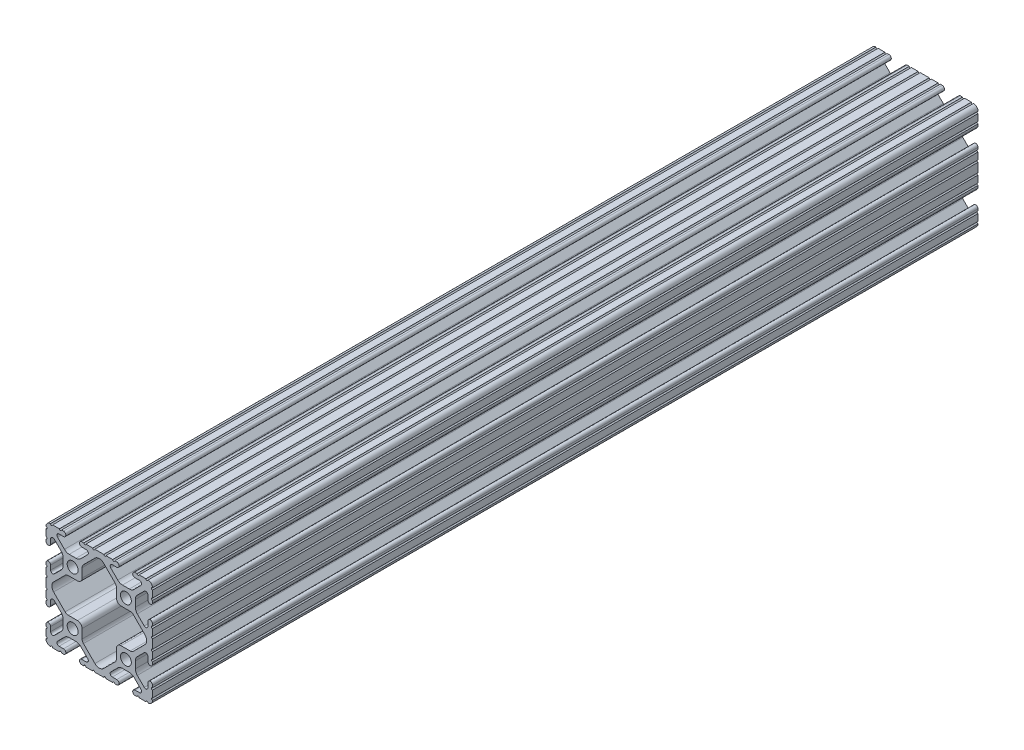
from build123d import *

# Parameters (mm, degrees)
SKETCH1_R      = 2.6035
EXTRUDE1_DEPTH = 196.85


with BuildPart() as part:
    # Sketch1 → Extrude1 (new, symmetric)
    with BuildSketch(Plane.XY):
        with BuildLine():
            Line((-2.1336, -25.4), (2.1336, -25.4))
            ThreePointArc((2.1336, -25.4), (2.6416, -24.892), (3.1496, -25.4))
            Line((3.1496, -25.4), (6.3754, -25.4))
            ThreePointArc((6.3754, -25.4), (6.8834, -24.892), (7.3914, -25.4))
            Line((7.3914, -25.4), (8.3439, -25.4))
            ThreePointArc((8.3439, -25.4), (9.4488, -24.2951), (8.3439, -23.1902))
            Line((8.3439, -23.1902), (6.225205544, -23.1902))
            ThreePointArc((6.225205544, -23.1902), (5.286543939, -22.563006367), (5.506785055, -21.45577951))
            Line((5.506785055, -21.45577951), (8.824128595, -18.13843597))
            ThreePointArc((8.824128595, -18.13843597), (9.854172728, -17.450182484), (11.069192626, -17.2085))
            Line((11.069192626, -17.2085), (14.330807374, -17.2085))
            ThreePointArc((14.330807374, -17.2085), (15.545827272, -17.450182484), (16.575871405, -18.13843597))
            Line((16.575871405, -18.13843597), (19.893214945, -21.45577951))
            ThreePointArc((19.893214945, -21.45577951), (20.113456061, -22.563006367), (19.174794456, -23.1902))
            Line((19.174794456, -23.1902), (17.0561, -23.1902))
            ThreePointArc((17.0561, -23.1902), (15.9512, -24.2951), (17.0561, -25.4))
            Line((17.0561, -25.4), (18.0086, -25.4))
            ThreePointArc((18.0086, -25.4), (18.5166, -24.892), (19.0246, -25.4))
            Line((19.0246, -25.4), (22.2504, -25.4))
            ThreePointArc((22.2504, -25.4), (22.7584, -24.892), (23.2664, -25.4))
            Line((23.2664, -25.4), (23.2918, -25.4))
            ThreePointArc((23.2918, -25.4), (24.782522516, -24.782522516), (25.4, -23.2918))
            Line((25.4, -23.2918), (25.4, -23.2664))
            ThreePointArc((25.4, -23.2664), (24.892, -22.7584), (25.4, -22.2504))
            Line((25.4, -22.2504), (25.4, -19.0246))
            ThreePointArc((25.4, -19.0246), (24.892, -18.5166), (25.4, -18.0086))
            Line((25.4, -18.0086), (25.4, -17.0561))
            ThreePointArc((25.4, -17.0561), (24.2951, -15.9512), (23.1902, -17.0561))
            Line((23.1902, -17.0561), (23.1902, -19.174794456))
            ThreePointArc((23.1902, -19.174794456), (22.563006367, -20.113456061), (21.45577951, -19.893214945))
            Line((21.45577951, -19.893214945), (18.13843597, -16.575871405))
            ThreePointArc((18.13843597, -16.575871405), (17.450182484, -15.545827272), (17.2085, -14.330807374))
            Line((17.2085, -14.330807374), (17.2085, -11.069192626))
            ThreePointArc((17.2085, -11.069192626), (17.450182484, -9.854172728), (18.13843597, -8.824128595))
            Line((18.13843597, -8.824128595), (21.45577951, -5.506785055))
            ThreePointArc((21.45577951, -5.506785055), (22.563006367, -5.286543939), (23.1902, -6.225205544))
            Line((23.1902, -6.225205544), (23.1902, -8.3439))
            ThreePointArc((23.1902, -8.3439), (24.2951, -9.4488), (25.4, -8.3439))
            Line((25.4, -8.3439), (25.4, -7.3914))
            ThreePointArc((25.4, -7.3914), (24.892, -6.8834), (25.4, -6.3754))
            Line((25.4, -6.3754), (25.4, -3.1496))
            ThreePointArc((25.4, -3.1496), (24.892, -2.6416), (25.4, -2.1336))
            Line((25.4, -2.1336), (25.4, 2.1336))
            ThreePointArc((25.4, 2.1336), (24.892, 2.6416), (25.4, 3.1496))
            Line((25.4, 3.1496), (25.4, 6.3754))
            ThreePointArc((25.4, 6.3754), (24.892, 6.8834), (25.4, 7.3914))
            Line((25.4, 7.3914), (25.4, 8.3439))
            ThreePointArc((25.4, 8.3439), (24.2951, 9.4488), (23.1902, 8.3439))
            Line((23.1902, 8.3439), (23.1902, 6.225205544))
            ThreePointArc((23.1902, 6.225205544), (22.563006367, 5.286543939), (21.45577951, 5.506785055))
            Line((21.45577951, 5.506785055), (18.13843597, 8.824128595))
            ThreePointArc((18.13843597, 8.824128595), (17.450182484, 9.854172728), (17.2085, 11.069192626))
            Line((17.2085, 11.069192626), (17.2085, 14.330807374))
            ThreePointArc((17.2085, 14.330807374), (17.450182484, 15.545827272), (18.13843597, 16.575871405))
            Line((18.13843597, 16.575871405), (21.45577951, 19.893214945))
            ThreePointArc((21.45577951, 19.893214945), (22.563006367, 20.113456061), (23.1902, 19.174794456))
            Line((23.1902, 19.174794456), (23.1902, 17.0561))
            ThreePointArc((23.1902, 17.0561), (24.2951, 15.9512), (25.4, 17.0561))
            Line((25.4, 17.0561), (25.4, 18.0086))
            ThreePointArc((25.4, 18.0086), (24.892, 18.5166), (25.4, 19.0246))
            Line((25.4, 19.0246), (25.4, 22.2504))
            ThreePointArc((25.4, 22.2504), (24.892, 22.7584), (25.4, 23.2664))
            Line((25.4, 23.2664), (25.4, 23.2918))
            ThreePointArc((25.4, 23.2918), (24.782522516, 24.782522516), (23.2918, 25.4))
            Line((23.2918, 25.4), (23.2664, 25.4))
            ThreePointArc((23.2664, 25.4), (22.7584, 24.892), (22.2504, 25.4))
            Line((22.2504, 25.4), (19.0246, 25.4))
            ThreePointArc((19.0246, 25.4), (18.5166, 24.892), (18.0086, 25.4))
            Line((18.0086, 25.4), (17.0561, 25.4))
            ThreePointArc((17.0561, 25.4), (15.9512, 24.2951), (17.0561, 23.1902))
            Line((17.0561, 23.1902), (19.174794456, 23.1902))
            ThreePointArc((19.174794456, 23.1902), (20.113456061, 22.563006367), (19.893214945, 21.45577951))
            Line((19.893214945, 21.45577951), (16.575871405, 18.13843597))
            ThreePointArc((16.575871405, 18.13843597), (15.545827272, 17.450182484), (14.330807374, 17.2085))
            Line((14.330807374, 17.2085), (11.069192626, 17.2085))
            ThreePointArc((11.069192626, 17.2085), (9.854172728, 17.450182484), (8.824128595, 18.13843597))
            Line((8.824128595, 18.13843597), (5.506785055, 21.45577951))
            ThreePointArc((5.506785055, 21.45577951), (5.286543939, 22.563006367), (6.225205544, 23.1902))
            Line((6.225205544, 23.1902), (8.3439, 23.1902))
            ThreePointArc((8.3439, 23.1902), (9.4488, 24.2951), (8.3439, 25.4))
            Line((8.3439, 25.4), (7.3914, 25.4))
            ThreePointArc((7.3914, 25.4), (6.8834, 24.892), (6.3754, 25.4))
            Line((6.3754, 25.4), (3.1496, 25.4))
            ThreePointArc((3.1496, 25.4), (2.6416, 24.892), (2.1336, 25.4))
            Line((2.1336, 25.4), (-2.1336, 25.4))
            ThreePointArc((-2.1336, 25.4), (-2.6416, 24.892), (-3.1496, 25.4))
            Line((-3.1496, 25.4), (-6.3754, 25.4))
            ThreePointArc((-6.3754, 25.4), (-6.8834, 24.892), (-7.3914, 25.4))
            Line((-7.3914, 25.4), (-8.3439, 25.4))
            ThreePointArc((-8.3439, 25.4), (-9.4488, 24.2951), (-8.3439, 23.1902))
            Line((-8.3439, 23.1902), (-6.225205544, 23.1902))
            ThreePointArc((-6.225205544, 23.1902), (-5.286543939, 22.563006367), (-5.506785055, 21.45577951))
            Line((-5.506785055, 21.45577951), (-8.824128595, 18.13843597))
            ThreePointArc((-8.824128595, 18.13843597), (-9.854172728, 17.450182484), (-11.069192626, 17.2085))
            Line((-11.069192626, 17.2085), (-14.330807374, 17.2085))
            ThreePointArc((-14.330807374, 17.2085), (-15.545827272, 17.450182484), (-16.575871405, 18.13843597))
            Line((-16.575871405, 18.13843597), (-19.893214945, 21.45577951))
            ThreePointArc((-19.893214945, 21.45577951), (-20.113456061, 22.563006367), (-19.174794456, 23.1902))
            Line((-19.174794456, 23.1902), (-17.0561, 23.1902))
            ThreePointArc((-17.0561, 23.1902), (-15.9512, 24.2951), (-17.0561, 25.4))
            Line((-17.0561, 25.4), (-18.0086, 25.4))
            ThreePointArc((-18.0086, 25.4), (-18.5166, 24.892), (-19.0246, 25.4))
            Line((-19.0246, 25.4), (-22.2504, 25.4))
            ThreePointArc((-22.2504, 25.4), (-22.7584, 24.892), (-23.2664, 25.4))
            Line((-23.2664, 25.4), (-23.2918, 25.4))
            ThreePointArc((-23.2918, 25.4), (-24.782522516, 24.782522516), (-25.4, 23.2918))
            Line((-25.4, 23.2918), (-25.4, 23.2664))
            ThreePointArc((-25.4, 23.2664), (-24.892, 22.7584), (-25.4, 22.2504))
            Line((-25.4, 22.2504), (-25.4, 19.0246))
            ThreePointArc((-25.4, 19.0246), (-24.892, 18.5166), (-25.4, 18.0086))
            Line((-25.4, 18.0086), (-25.4, 17.0561))
            ThreePointArc((-25.4, 17.0561), (-24.2951, 15.9512), (-23.1902, 17.0561))
            Line((-23.1902, 17.0561), (-23.1902, 19.174794456))
            ThreePointArc((-23.1902, 19.174794456), (-22.563006367, 20.113456061), (-21.45577951, 19.893214945))
            Line((-21.45577951, 19.893214945), (-18.13843597, 16.575871405))
            ThreePointArc((-18.13843597, 16.575871405), (-17.450182484, 15.545827272), (-17.2085, 14.330807374))
            Line((-17.2085, 14.330807374), (-17.2085, 11.069192626))
            ThreePointArc((-17.2085, 11.069192626), (-17.450182484, 9.854172728), (-18.13843597, 8.824128595))
            Line((-18.13843597, 8.824128595), (-21.45577951, 5.506785055))
            ThreePointArc((-21.45577951, 5.506785055), (-22.563006367, 5.286543939), (-23.1902, 6.225205544))
            Line((-23.1902, 6.225205544), (-23.1902, 8.3439))
            ThreePointArc((-23.1902, 8.3439), (-24.2951, 9.4488), (-25.4, 8.3439))
            Line((-25.4, 8.3439), (-25.4, 7.3914))
            ThreePointArc((-25.4, 7.3914), (-24.892, 6.8834), (-25.4, 6.3754))
            Line((-25.4, 6.3754), (-25.4, 3.1496))
            ThreePointArc((-25.4, 3.1496), (-24.892, 2.6416), (-25.4, 2.1336))
            Line((-25.4, 2.1336), (-25.4, -2.1336))
            ThreePointArc((-25.4, -2.1336), (-24.892, -2.6416), (-25.4, -3.1496))
            Line((-25.4, -3.1496), (-25.4, -6.3754))
            ThreePointArc((-25.4, -6.3754), (-24.892, -6.8834), (-25.4, -7.3914))
            Line((-25.4, -7.3914), (-25.4, -8.3439))
            ThreePointArc((-25.4, -8.3439), (-24.2951, -9.4488), (-23.1902, -8.3439))
            Line((-23.1902, -8.3439), (-23.1902, -6.225205544))
            ThreePointArc((-23.1902, -6.225205544), (-22.563006367, -5.286543939), (-21.45577951, -5.506785055))
            Line((-21.45577951, -5.506785055), (-18.13843597, -8.824128595))
            ThreePointArc((-18.13843597, -8.824128595), (-17.450182484, -9.854172728), (-17.2085, -11.069192626))
            Line((-17.2085, -11.069192626), (-17.2085, -14.330807374))
            ThreePointArc((-17.2085, -14.330807374), (-17.450182484, -15.545827272), (-18.13843597, -16.575871405))
            Line((-18.13843597, -16.575871405), (-21.45577951, -19.893214945))
            ThreePointArc((-21.45577951, -19.893214945), (-22.563006367, -20.113456061), (-23.1902, -19.174794456))
            Line((-23.1902, -19.174794456), (-23.1902, -17.0561))
            ThreePointArc((-23.1902, -17.0561), (-24.2951, -15.9512), (-25.4, -17.0561))
            Line((-25.4, -17.0561), (-25.4, -18.0086))
            ThreePointArc((-25.4, -18.0086), (-24.892, -18.5166), (-25.4, -19.0246))
            Line((-25.4, -19.0246), (-25.4, -22.2504))
            ThreePointArc((-25.4, -22.2504), (-24.892, -22.7584), (-25.4, -23.2664))
            Line((-25.4, -23.2664), (-25.4, -23.2918))
            ThreePointArc((-25.4, -23.2918), (-24.782522516, -24.782522516), (-23.2918, -25.4))
            Line((-23.2918, -25.4), (-23.2664, -25.4))
            ThreePointArc((-23.2664, -25.4), (-22.7584, -24.892), (-22.2504, -25.4))
            Line((-22.2504, -25.4), (-19.0246, -25.4))
            ThreePointArc((-19.0246, -25.4), (-18.5166, -24.892), (-18.0086, -25.4))
            Line((-18.0086, -25.4), (-17.0561, -25.4))
            ThreePointArc((-17.0561, -25.4), (-15.9512, -24.2951), (-17.0561, -23.1902))
            Line((-17.0561, -23.1902), (-19.174794456, -23.1902))
            ThreePointArc((-19.174794456, -23.1902), (-20.113456061, -22.563006367), (-19.893214945, -21.45577951))
            Line((-19.893214945, -21.45577951), (-16.575871405, -18.13843597))
            ThreePointArc((-16.575871405, -18.13843597), (-15.545827272, -17.450182484), (-14.330807374, -17.2085))
            Line((-14.330807374, -17.2085), (-11.069192626, -17.2085))
            ThreePointArc((-11.069192626, -17.2085), (-9.854172728, -17.450182484), (-8.824128595, -18.13843597))
            Line((-8.824128595, -18.13843597), (-5.506785055, -21.45577951))
            ThreePointArc((-5.506785055, -21.45577951), (-5.286543939, -22.563006367), (-6.225205544, -23.1902))
            Line((-6.225205544, -23.1902), (-8.3439, -23.1902))
            ThreePointArc((-8.3439, -23.1902), (-9.4488, -24.2951), (-8.3439, -25.4))
            Line((-8.3439, -25.4), (-7.3914, -25.4))
            ThreePointArc((-7.3914, -25.4), (-6.8834, -24.892), (-6.3754, -25.4))
            Line((-6.3754, -25.4), (-3.1496, -25.4))
            ThreePointArc((-3.1496, -25.4), (-2.6416, -24.892), (-2.1336, -25.4))
        make_face()
        with Locations((12.7, 12.7)):
            Circle(SKETCH1_R, mode=Mode.SUBTRACT)
        with Locations((12.7, -12.7)):
            Circle(SKETCH1_R, mode=Mode.SUBTRACT)
        with Locations((-12.7, 12.7)):
            Circle(SKETCH1_R, mode=Mode.SUBTRACT)
        with Locations((-12.7, -12.7)):
            Circle(SKETCH1_R, mode=Mode.SUBTRACT)
        with BuildLine():
            Line((-10.4013, 8.1915), (-14.730606305, 8.1915))
            ThreePointArc((-14.730606305, 8.1915), (-15.576260154, 8.023288991), (-16.29317087, 7.544264565))
            Line((-16.29317087, 7.544264565), (-21.771976527, 2.065458908))
            ThreePointArc((-21.771976527, 2.065458908), (-22.627517619, 0), (-21.771976527, -2.065458908))
            Line((-21.771976527, -2.065458908), (-16.29317087, -7.544264565))
            ThreePointArc((-16.29317087, -7.544264565), (-15.576260154, -8.023288991), (-14.730606305, -8.1915))
            Line((-14.730606305, -8.1915), (-10.4013, -8.1915))
            ThreePointArc((-10.4013, -8.1915), (-8.838735435, -8.838735435), (-8.1915, -10.4013))
            Line((-8.1915, -10.4013), (-8.1915, -14.730606305))
            ThreePointArc((-8.1915, -14.730606305), (-8.023288991, -15.576260154), (-7.544264565, -16.29317087))
            Line((-7.544264565, -16.29317087), (-2.065458908, -21.771976527))
            ThreePointArc((-2.065458908, -21.771976527), (0, -22.627517619), (2.065458908, -21.771976527))
            Line((2.065458908, -21.771976527), (7.544264565, -16.29317087))
            ThreePointArc((7.544264565, -16.29317087), (8.023288991, -15.576260154), (8.1915, -14.730606305))
            Line((8.1915, -14.730606305), (8.1915, -10.4013))
            ThreePointArc((8.1915, -10.4013), (8.838735435, -8.838735435), (10.4013, -8.1915))
            Line((10.4013, -8.1915), (14.730606305, -8.1915))
            ThreePointArc((14.730606305, -8.1915), (15.576260154, -8.023288991), (16.29317087, -7.544264565))
            Line((16.29317087, -7.544264565), (21.771976527, -2.065458908))
            ThreePointArc((21.771976527, -2.065458908), (22.627517619, 0), (21.771976527, 2.065458908))
            Line((21.771976527, 2.065458908), (16.29317087, 7.544264565))
            ThreePointArc((16.29317087, 7.544264565), (15.576260154, 8.023288991), (14.730606305, 8.1915))
            Line((14.730606305, 8.1915), (10.4013, 8.1915))
            ThreePointArc((10.4013, 8.1915), (8.838735435, 8.838735435), (8.1915, 10.4013))
            Line((8.1915, 10.4013), (8.1915, 14.730606305))
            ThreePointArc((8.1915, 14.730606305), (8.023288991, 15.576260154), (7.544264565, 16.29317087))
            Line((7.544264565, 16.29317087), (2.065458908, 21.771976527))
            ThreePointArc((2.065458908, 21.771976527), (0, 22.627517619), (-2.065458908, 21.771976527))
            Line((-2.065458908, 21.771976527), (-7.544264565, 16.29317087))
            ThreePointArc((-7.544264565, 16.29317087), (-8.023288991, 15.576260154), (-8.1915, 14.730606305))
            Line((-8.1915, 14.730606305), (-8.1915, 10.4013))
            ThreePointArc((-8.1915, 10.4013), (-8.838735435, 8.838735435), (-10.4013, 8.1915))
        make_face(mode=Mode.SUBTRACT)
    extrude(amount=EXTRUDE1_DEPTH, both=True)


solid = part.part
